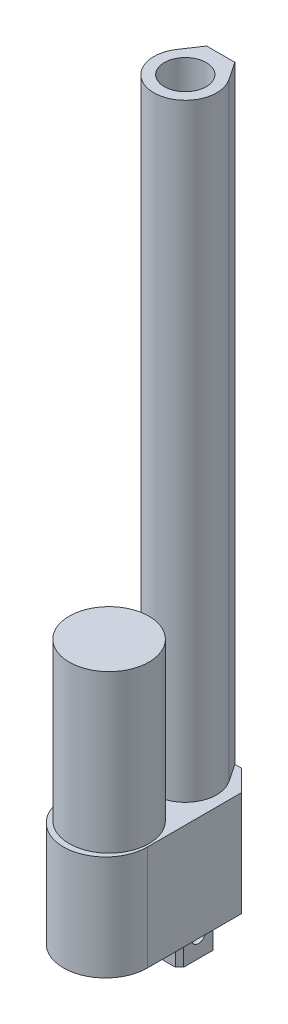
from build123d import *

# Parameters (mm, degrees)
EXTRUDE_1_DEPTH     = 50
SKETCH_2_R          = 19
EXTRUDE_2_DEPTH     = 75
EXTRUDE_3_DEPTH     = 290
SKETCH_4_R          = 10
CUT_EXTRUDE_1_DEPTH = 170
SKETCH_5_W          = 18
SKETCH_5_H          = 18
EXTRUDE_4_DEPTH     = 19
SKETCH_7_R          = 3.25
CUT_EXTRUDE_2_DEPTH = 19
CHAMFER_1_SIZE      = 10
CHAMFER_2_SIZE      = 2


with BuildPart() as part:
    # 草图1 → 凸台-拉伸1 (new body)
    with BuildSketch(Plane(origin=(0, 0, 0), x_dir=(1, 0, 0), z_dir=(0, 1, 0))):
        with BuildLine():
            Line((-20, 27.5), (20, 27.5))
            Line((20, 27.5), (20, -27.5))
            ThreePointArc((20, -27.5), (0, -47.5), (-20, -27.5))
            Line((-20, -27.5), (-20, 27.5))
        make_face()
    extrude(amount=EXTRUDE_1_DEPTH)

    # 草图2 → 凸台-拉伸2 (add)
    with BuildSketch(Plane(origin=(0, 50, 0), x_dir=(1, 0, 0), z_dir=(0, 1, 0))):
        with Locations(Location((0, -25.772612345, 0), (0, 0, 270))):
            Circle(SKETCH_2_R)
    extrude(amount=EXTRUDE_2_DEPTH)

    # 草图3 → 凸台-拉伸3 (add)
    with BuildSketch(Plane(origin=(0, 50, 0), x_dir=(1, 0, 0), z_dir=(0, 1, 0))):
        with BuildLine():
            Line((-12.473266485, 18.913505227), (-6.7377758, 27.5))
            Line((-6.7377758, 27.5), (6.7377758, 27.5))
            Line((6.7377758, 27.5), (12.473266485, 18.913505227))
            ThreePointArc((12.473266485, 18.913505227), (0, -4.418218675), (-12.473266485, 18.913505227))
        make_face()
    extrude(amount=EXTRUDE_3_DEPTH)

    # 草图4 → 切除-拉伸1 (cut)
    with BuildSketch(Plane(origin=(0, 340, 0), x_dir=(1, 0, 0), z_dir=(0, 1, 0))):
        with Locations(Location((0, 10.581781325, 0), (0, 0, 270))):
            Circle(SKETCH_4_R)
    extrude(amount=-CUT_EXTRUDE_1_DEPTH, mode=Mode.SUBTRACT)

    # 草图5 → 凸台-拉伸4 (add)
    with BuildSketch(Plane.XZ):
        with Locations((0.33262197, -7.5)):
            Rectangle(SKETCH_5_W, SKETCH_5_H)
    extrude(amount=EXTRUDE_4_DEPTH)

    # 草图7 → 切除-拉伸2 (cut)
    with BuildSketch(Plane(origin=(9.33262197, 0, 0), x_dir=(0, 0, -1), z_dir=(1, 0, 0))):
        with Locations((7.5, -9.5)):
            Circle(SKETCH_7_R)
    extrude(amount=-CUT_EXTRUDE_2_DEPTH, mode=Mode.SUBTRACT)

    # 倒角1
    chamfer_1_edges = [part.edges().sort_by_distance(p)[0] for p in [
        (-20, 25, -27.5),
        (20, 25, -27.5),
    ]]
    chamfer(chamfer_1_edges, length=CHAMFER_1_SIZE)

    # 倒角2
    chamfer_2_edges = [part.edges().sort_by_distance(p)[0] for p in [
        (9.33262197, -9.5, -16.5),
        (9.33262197, -9.5, 1.5),
        (-8.66737803, -9.5, 1.5),
        (-8.66737803, -9.5, -16.5),
    ]]
    chamfer(chamfer_2_edges, length=CHAMFER_2_SIZE)


solid = part.part
